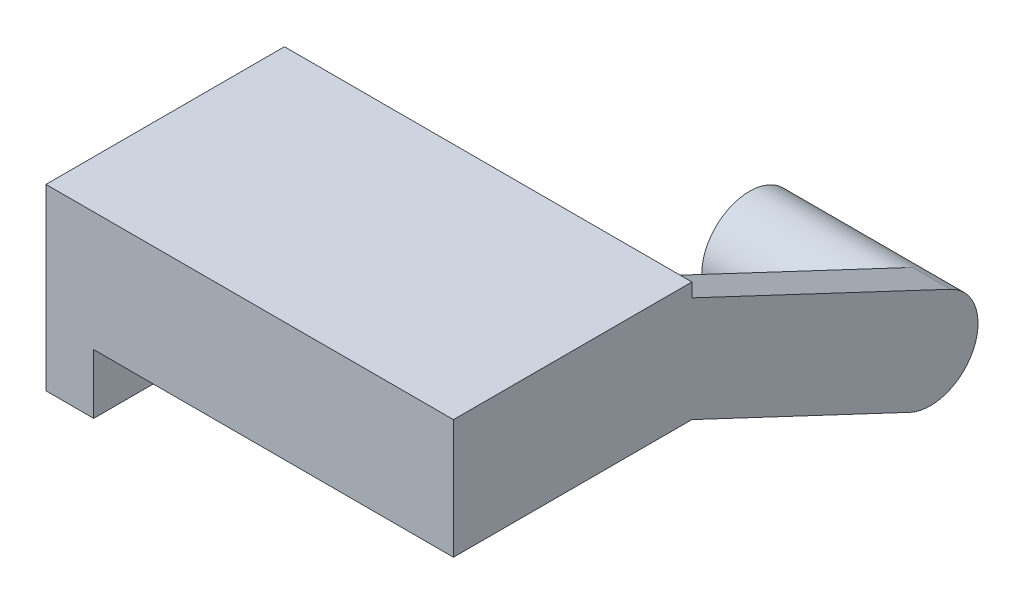
from build123d import *

# Parameters (mm, degrees)
SKETCH1_W           = 20
SKETCH1_H           = 15
SKETCH1_R           = 1.35
BOSS_EXTRUDE1_DEPTH = 4
SKETCH2_W           = 20
SKETCH2_H           = 10
BOSS_EXTRUDE2_DEPTH = 27
BOSS_EXTRUDE3_DEPTH = 3.175
BOSS_EXTRUDE4_START = 12
SKETCH4_R           = 4
BOSS_EXTRUDE4_DEPTH = 12


with BuildPart() as part:
    # Sketch1 → Boss-Extrude1 (new body)
    with BuildSketch(Plane(origin=(0, 0, 0), x_dir=(0, 0, -1), z_dir=(1, 0, 0))):
        Rectangle(SKETCH1_W, SKETCH1_H)
        with Locations((-5, -5)):
            Circle(SKETCH1_R, mode=Mode.SUBTRACT)
        with Locations((5, -5)):
            Circle(SKETCH1_R, mode=Mode.SUBTRACT)
    extrude(amount=BOSS_EXTRUDE1_DEPTH)

    # Sketch2 → Boss-Extrude2 (add)
    with BuildSketch(Plane(origin=(4, 0, 0), x_dir=(0, 0, -1), z_dir=(1, 0, 0))):
        with Locations((0, 2.5)):
            Rectangle(SKETCH2_W, SKETCH2_H)
    extrude(amount=BOSS_EXTRUDE2_DEPTH)

    # Sketch3 → Boss-Extrude3 (add)
    with BuildSketch(Plane(origin=(31, 0, 0), x_dir=(0, 0, -1), z_dir=(1, 0, 0))):
        with BuildLine():
            Line((10, 7.5), (-10, 7.5))
            Line((-10, 7.5), (-10, -2.5))
            Line((-10, -2.5), (10, -2.5))
            Line((10, -2.5), (28.295353016, -11.118587937))
            ThreePointArc((28.295353016, -11.118587937), (33.618587937, -9.204646984), (31.704646984, -3.881412063))
            Line((31.704646984, -3.881412063), (10, 6.343228507))
            Line((10, 6.343228507), (10, 7.5))
        make_face()
    extrude(amount=BOSS_EXTRUDE3_DEPTH)

    # Sketch4 → Boss-Extrude4 (add)
    with BuildSketch(Plane.ZY.offset(-31).offset(BOSS_EXTRUDE4_START)):
        with Locations((-30, -7.5)):
            Circle(SKETCH4_R)
    extrude(amount=-BOSS_EXTRUDE4_DEPTH)


solid = part.part
